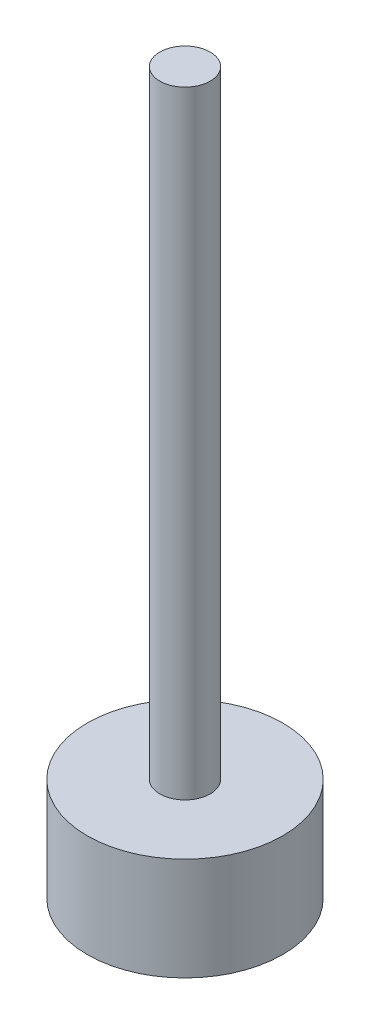
from build123d import *

# Parameters (mm, degrees)
SKETCH1_R           = 12.065
BOSS_EXTRUDE1_DEPTH = 12.7
SKETCH2_R           = 3.1115
BOSS_EXTRUDE2_DEPTH = 76.2


with BuildPart() as part:
    # Sketch1 → Boss-Extrude1 (new body)
    with BuildSketch(Plane(origin=(0, 0, 0), x_dir=(1, 0, 0), z_dir=(0, 1, 0))):
        with Locations(Location((0, 0, 0), (0, 0, 270))):
            Circle(SKETCH1_R)
    extrude(amount=BOSS_EXTRUDE1_DEPTH)

    # Sketch2 → Boss-Extrude2 (add)
    with BuildSketch(Plane(origin=(0, 12.7, 0), x_dir=(1, 0, 0), z_dir=(0, 1, 0))):
        with Locations(Location((0, 0, 0), (0, 0, 90))):
            Circle(SKETCH2_R)
    extrude(amount=BOSS_EXTRUDE2_DEPTH)


solid = part.part
